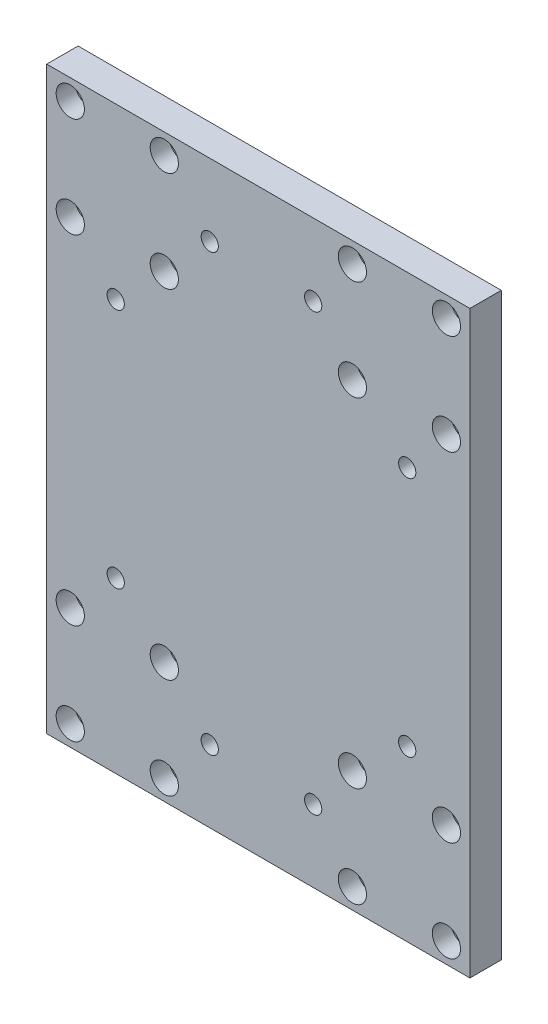
from build123d import *

# Parameters (mm, degrees)
SZKIC1_W                                             = 135
SZKIC1_H                                             = 185
DODANIE_WYCI_GNI_CIE1_DEPTH                          = 10
POG_BIENIE_WALCOWE_POD_M5_WKR_T_DO_CZ_CI_D           = 5.5
POG_BIENIE_WALCOWE_POD_M5_WKR_T_DO_CZ_CI_CBORE_D     = 9
POG_BIENIE_WALCOWE_POD_M5_WKR_T_DO_CZ_CI_CBORE_DEPTH = 6
SZKIC5_R                                             = 2.75
WYTNIJ_WYCI_GNI_CIE1_DEPTH                           = 230.237867727


with BuildPart() as part:
    # Szkic1 → Dodanie-wyciągnięcie1 (new body)
    with BuildSketch(Plane.XY):
        with Locations((67.5, 92.5)):
            Rectangle(SZKIC1_W, SZKIC1_H)
    extrude(amount=DODANIE_WYCI_GNI_CIE1_DEPTH)

    # Pogłębienie walcowe pod M5 Wkręt do części metalowych z łbem sześciokątnym1 (through all)
    with Locations(Plane.XY.offset(10)):
        with Locations((7.5, 178.5), (37.5, 178.5), (37.5, 146.5), (7.5, 146.5), (7.5, 38.5), (37.5, 38.5), (7.5, 6.5), (37.5, 6.5), (97.5, 6.5), (127.5, 6.5), (97.5, 38.5), (127.5, 38.5), (127.5, 146.5), (97.5, 146.5), (97.5, 178.5), (127.5, 178.5)):
            CounterBoreHole(POG_BIENIE_WALCOWE_POD_M5_WKR_T_DO_CZ_CI_D / 2, POG_BIENIE_WALCOWE_POD_M5_WKR_T_DO_CZ_CI_CBORE_D / 2, POG_BIENIE_WALCOWE_POD_M5_WKR_T_DO_CZ_CI_CBORE_DEPTH)

    # Szkic5 → Wytnij-wyciągnięcie1 (cut, through all)
    with BuildSketch(Plane.XY.offset(10)):
        with Locations((22, 54)):
            Circle(SZKIC5_R)
        with Locations((52, 23)):
            Circle(SZKIC5_R)
        with Locations((85, 23)):
            Circle(SZKIC5_R)
        with Locations((115, 54)):
            Circle(SZKIC5_R)
        with Locations(Location((52, 162, 0), (0, 0, 180))):
            Circle(SZKIC5_R)
        with Locations(Location((22, 131, 0), (0, 0, 180))):
            Circle(SZKIC5_R)
        with Locations(Location((115, 131, 0), (0, 0, 180))):
            Circle(SZKIC5_R)
        with Locations(Location((85, 162, 0), (0, 0, 180))):
            Circle(SZKIC5_R)
    extrude(amount=-WYTNIJ_WYCI_GNI_CIE1_DEPTH, mode=Mode.SUBTRACT)


solid = part.part
